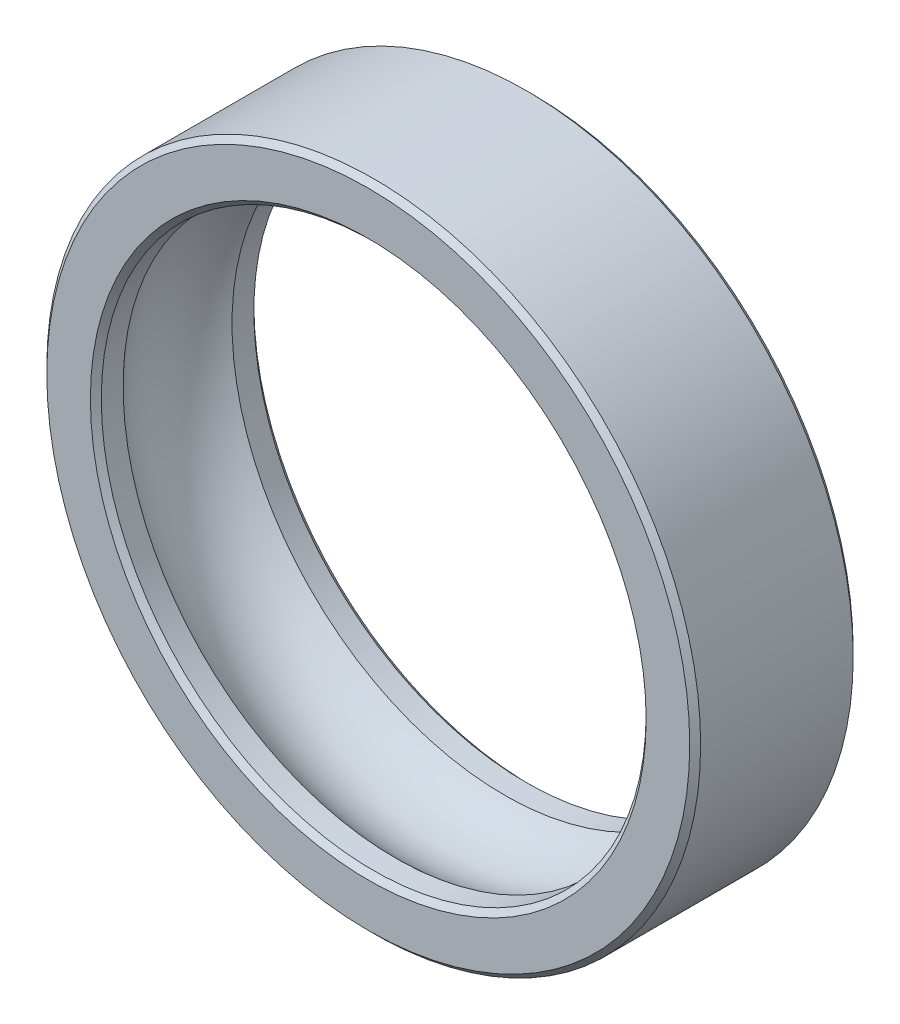
from build123d import *

# Parameters (mm, degrees)
CHAMFER1_SIZE = 25.4


with BuildPart() as part:
    # Sketch1 → Revolve1 (revolve)
    with BuildSketch(Plane(origin=(0, 0, 0), x_dir=(0, 0, -1), z_dir=(1, 0, 0)), mode=Mode.PRIVATE) as revolve1_sk:
        with BuildLine():
            Line((-381, 1524), (381, 1524))
            Line((381, 1524), (381, 1270))
            Line((381, 1270), (254, 1270))
            ThreePointArc((254, 1270), (0, 1375.210244843), (-254, 1270))
            Line((-254, 1270), (-381, 1270))
            Line((-381, 1270), (-381, 1524))
        make_face()
    revolve(revolve1_sk.sketch.rotate(Axis((0, 0, 0), (0, 0, -1)), 90), axis=Axis((0, 0, 0), (0, 0, -1)))

    # Chamfer1
    chamfer1_edges = [part.edges().sort_by_distance(p)[0] for p in [
        (-1270, 0, -381),
        (-1524, 0, -381),
        (-1524, 0, 381),
        (-1270, 0, 381),
    ]]
    chamfer(chamfer1_edges, length=CHAMFER1_SIZE)


solid = part.part
